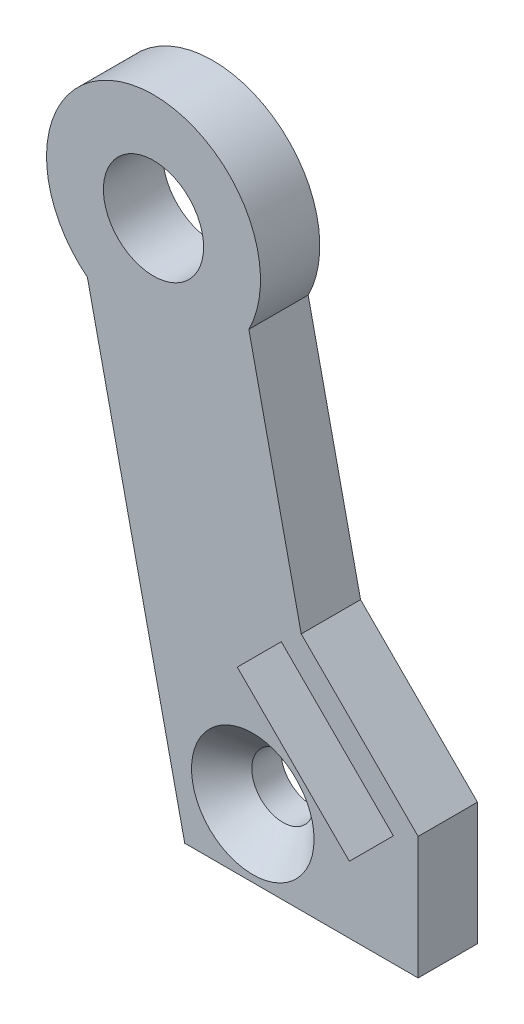
from build123d import *

# Parameters (mm, degrees)
SKETCH1_R           = 1.5
SKETCH1_R_2         = 2.575
BOSS_EXTRUDE1_DEPTH = 3.05


with BuildPart() as part:
    # Sketch1 → Boss-Extrude1 (new body)
    with BuildSketch(Plane.XY):
        with BuildLine():
            Line((-5.003856518, 22.700252006), (0, 0))
            Line((0, 0), (12, 0))
            Line((12, 0), (12, 6.303908615))
            Line((12, 6.303908615), (5.98959236, 12.314316255))
            Line((5.98959236, 12.314316255), (3.296868681, 24.529995477))
            ThreePointArc((3.296868681, 24.529995477), (-2.788944901, 32.395396494), (-5.003856518, 22.700252006))
        make_face()
        with Locations((3.5, 3.5)):
            Circle(SKETCH1_R, mode=Mode.SUBTRACT)
        Polygon((10.727207794, 5.692209589), (8.517499103, 3.482500897), (8.464466094, 3.429467889), (2.701545827, 9.192388155), (4.964287527, 11.455129855), align=None, mode=Mode.SUBTRACT)
        with Locations((-1.604993243, 27.024339012)):
            Circle(SKETCH1_R_2, mode=Mode.SUBTRACT)
    extrude(amount=BOSS_EXTRUDE1_DEPTH)

    # Sketch3 → CSK for M3 Flat Head Machine Screw1 (revolve, cut)
    with BuildSketch(Plane(origin=(3.5, 3.5, 3.05), x_dir=(0, -1, 0), z_dir=(1, 0, 0))):
        Polygon((0, 0), (0, 3.05), (1.6, 3.05), (1.6, 1.55), (3.15, 0), align=None)
    revolve(axis=Axis((3.5, 3.5, 9.4), (0, 0, -1)), mode=Mode.SUBTRACT)


solid = part.part
